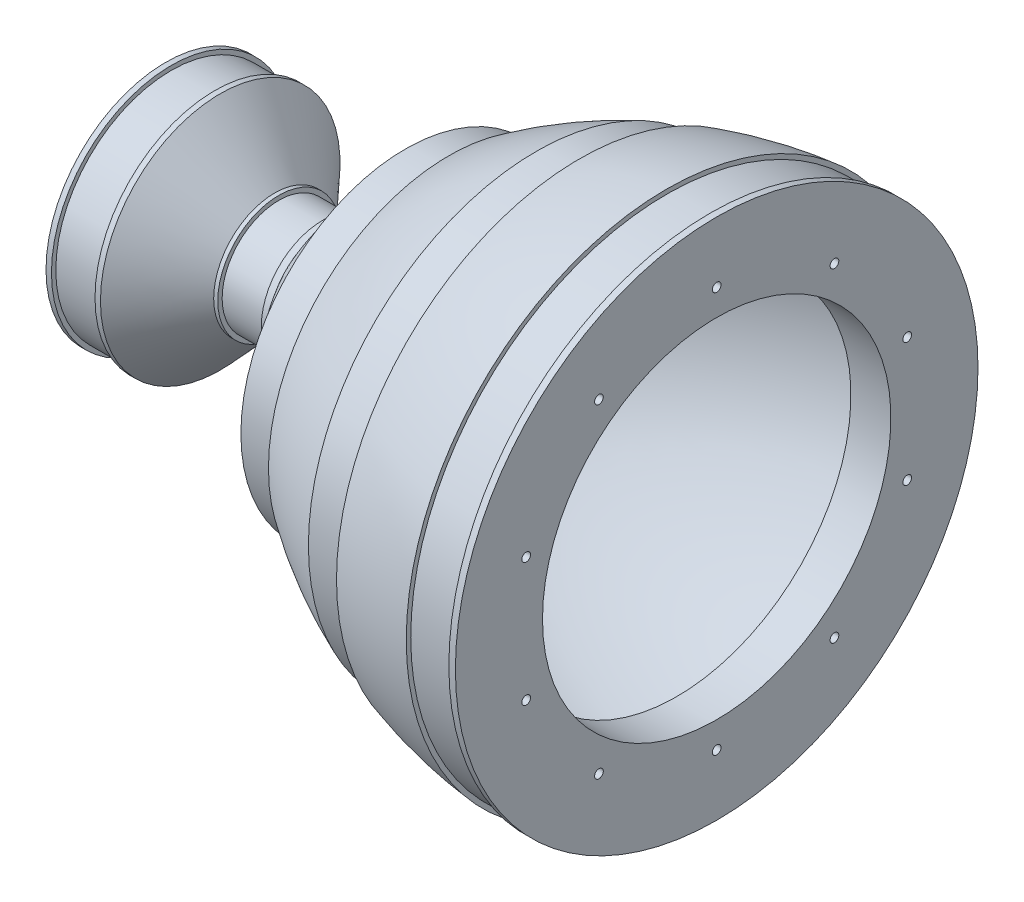
from build123d import *

# Parameters (mm, degrees)
SKETCH3_R          = 2
CUT_EXTRUDE1_DEPTH = 10
SKETCH4_R          = 2
CUT_EXTRUDE2_DEPTH = 10


with BuildPart() as part:
    # Sketch1 → Revolve3 (revolve)
    with BuildSketch(Plane.XY, mode=Mode.PRIVATE) as revolve3_sk:
        with BuildLine():
            Line((-6.205707302, 80), (-24.563281142, 80))
            Line((-24.563281142, 80), (-24.563281142, 110))
            ThreePointArc((-24.563281142, 110), (-111.666310606, 82.552480161), (-178.205707302, 20))
            Line((-178.205707302, 20), (-213.033718137, 20))
            Line((-213.033718137, 20), (-239.205707302, 48.265748299))
            Line((-239.205707302, 48.265748299), (-249.205707302, 48.265748299))
            Line((-249.205707302, 48.265748299), (-249.205707302, 30))
            Line((-249.205707302, 30), (-259.205707302, 30))
            Line((-259.205707302, 30), (-259.205707302, 55))
            Line((-259.205707302, 55), (-256.705707302, 55))
            Line((-256.705707302, 55), (-256.705707302, 53))
            Line((-256.705707302, 53), (-236.705707302, 53))
            Line((-236.705707302, 53), (-236.705707302, 55))
            Line((-236.705707302, 55), (-234.205707302, 55))
            Line((-234.205707302, 55), (-209.205707302, 28))
            Line((-209.205707302, 28), (-207.31461189, 28))
            Line((-207.31461189, 28), (-207.31461189, 26))
            Line((-207.31461189, 26), (-187.31461189, 26))
            Line((-187.31461189, 26), (-187.31461189, 28))
            Line((-187.31461189, 28), (-184.205707302, 28))
            ThreePointArc((-184.205707302, 28), (-167.911507534, 48.712256642), (-149.205707302, 67.275434145))
            Line((-149.205707302, 67.275434145), (-149.205707302, 75.5))
            Line((-149.205707302, 75.5), (-129.205707302, 75.5))
            Line((-129.205707302, 75.5), (-129.205707302, 82.838508469))
            ThreePointArc((-129.205707302, 82.838508469), (-109.780198591, 94.730106924), (-89.205707302, 104.5))
            Line((-89.205707302, 104.5), (-69.205707302, 104.5))
            Line((-69.205707302, 104.5), (-69.205707302, 111.59643719))
            ThreePointArc((-69.205707302, 111.59643719), (-49.395048279, 116.53049781), (-29.205707302, 119.563264874))
            Line((-29.205707302, 119.563264874), (-29.205707302, 117.5))
            Line((-29.205707302, 117.5), (-9.205707302, 117.5))
            Line((-9.205707302, 117.5), (-9.205707302, 120))
            Line((-9.205707302, 120), (-6.205707302, 120))
            Line((-6.205707302, 120), (-6.205707302, 80))
        make_face()
    revolve(revolve3_sk.sketch.rotate(Axis((-303.234759745, 0, 0), (1, 0, 0)), 90), axis=Axis((-303.234759745, 0, 0), (1, 0, 0)))

    # Sketch3 → Cut-Extrude1 (cut)
    with BuildSketch(Plane(origin=(-6.205707302, 0, 0), x_dir=(0, 0, -1), z_dir=(1, 0, 0))):
        with Locations((0, 92)):
            Circle(SKETCH3_R)
        with Locations((54.076243211, 74.429563482)):
            Circle(SKETCH3_R)
        with Locations((87.497199499, 28.429563482)):
            Circle(SKETCH3_R)
        with Locations((87.497199499, -28.429563482)):
            Circle(SKETCH3_R)
        with Locations((54.076243211, -74.429563482)):
            Circle(SKETCH3_R)
        with Locations((0, -92)):
            Circle(SKETCH3_R)
        with Locations((-54.076243211, -74.429563482)):
            Circle(SKETCH3_R)
        with Locations((-87.497199499, -28.429563482)):
            Circle(SKETCH3_R)
        with Locations((-87.497199499, 28.429563482)):
            Circle(SKETCH3_R)
        with Locations((-54.076243211, 74.429563482)):
            Circle(SKETCH3_R)
    extrude(amount=-CUT_EXTRUDE1_DEPTH, mode=Mode.SUBTRACT)

    # Sketch4 → Cut-Extrude2 (cut)
    with BuildSketch(Plane.ZY.offset(259.205707302)):
        with Locations((0, 47.5)):
            Circle(SKETCH4_R)
        with Locations((27.919799484, 38.428307233)):
            Circle(SKETCH4_R)
        with Locations((45.175184524, 14.678307233)):
            Circle(SKETCH4_R)
        with Locations((45.175184524, -14.678307233)):
            Circle(SKETCH4_R)
        with Locations((27.919799484, -38.428307233)):
            Circle(SKETCH4_R)
        with Locations((0, -47.5)):
            Circle(SKETCH4_R)
        with Locations((-27.919799484, -38.428307233)):
            Circle(SKETCH4_R)
        with Locations((-45.175184524, -14.678307233)):
            Circle(SKETCH4_R)
        with Locations((-45.175184524, 14.678307233)):
            Circle(SKETCH4_R)
        with Locations((-27.919799484, 38.428307233)):
            Circle(SKETCH4_R)
    extrude(amount=-CUT_EXTRUDE2_DEPTH, mode=Mode.SUBTRACT)


solid = part.part
